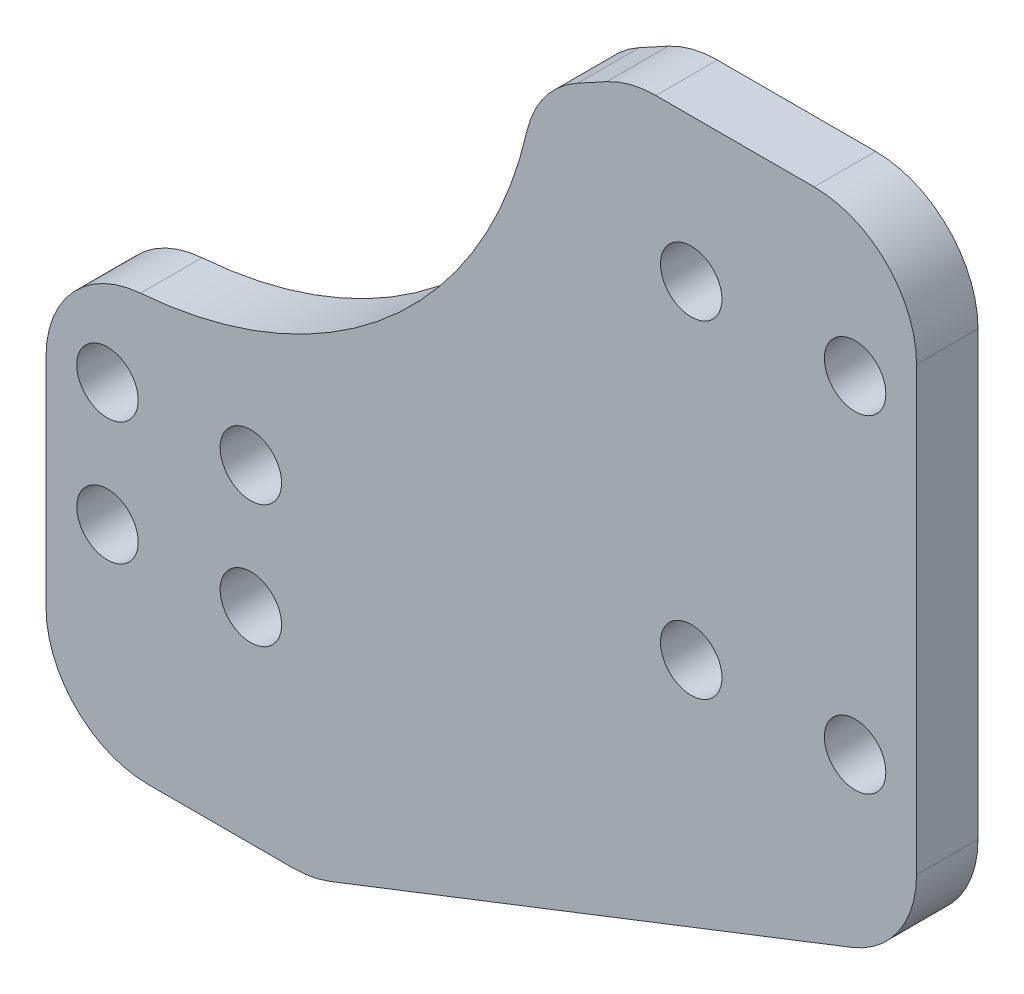
from build123d import *

# Parameters (mm, degrees)
SKETCH_1_W          = 13
SKETCH_1_H          = 26
SKETCH_1_R          = 1.5
SKETCH_1_W_2        = 14
SKETCH_1_H_2        = 30
EXTRUDE_1_DEPTH     = 3
SKETCH_2_R          = 21
CUT_EXTRUDE_1_DEPTH = 3
FILLET_1_R          = 5


with BuildPart() as part:
    # 草图1 → 凸台-拉伸1 (new body)
    # profile 1 of 3: a face of its own
    with BuildSketch(Plane.XY):
        Rectangle(SKETCH_1_W, SKETCH_1_H)
        with Locations((-3.5, 3)):
            Circle(SKETCH_1_R, mode=Mode.SUBTRACT)
        with Locations((-3.5, -3)):
            Circle(SKETCH_1_R, mode=Mode.SUBTRACT)
        with Locations((3.5, -3)):
            Circle(SKETCH_1_R, mode=Mode.SUBTRACT)
        with Locations((3.5, 3)):
            Circle(SKETCH_1_R, mode=Mode.SUBTRACT)
    # profile 2 of 3: a face of its own
    with BuildSketch(Plane.XY):
        Polygon((22, 28.52), (22, -1.48), (36, -1.48), (6.5, -13), (6.5, 13), (-6.5, 13), align=None)
    # profile 3 of 3: a face of its own
    with BuildSketch(Plane.XY):
        with Locations((29, 13.52)):
            Rectangle(SKETCH_1_W_2, SKETCH_1_H_2)
        with Locations((25, 21.52)):
            Circle(SKETCH_1_R, mode=Mode.SUBTRACT)
        with Locations((25, 5.52)):
            Circle(SKETCH_1_R, mode=Mode.SUBTRACT)
        with Locations((33, 5.52)):
            Circle(SKETCH_1_R, mode=Mode.SUBTRACT)
        with Locations((33, 21.52)):
            Circle(SKETCH_1_R, mode=Mode.SUBTRACT)
    extrude(amount=EXTRUDE_1_DEPTH)

    # 草图2 → 切除-拉伸1 (cut)
    with BuildSketch(Plane.XY.offset(3)):
        with Locations((-3.5, 28.52)):
            Circle(SKETCH_2_R)
    extrude(amount=-CUT_EXTRUDE_1_DEPTH, mode=Mode.SUBTRACT)

    # 圆角1
    fillet_1_edges = [part.edges().sort_by_distance(p)[0] for p in [
        (-6.5, -13, 1.5),
        (22, 28.52, 1.5),
        (36, 28.52, 1.5),
        (36, -1.48, 1.5),
        (6.5, -13, 1.5),
        (17.346543443, 25.985907166, 1.5),
        (-6.5, 7.735390309, 1.5),
    ]]
    fillet(fillet_1_edges, radius=FILLET_1_R)


solid = part.part
